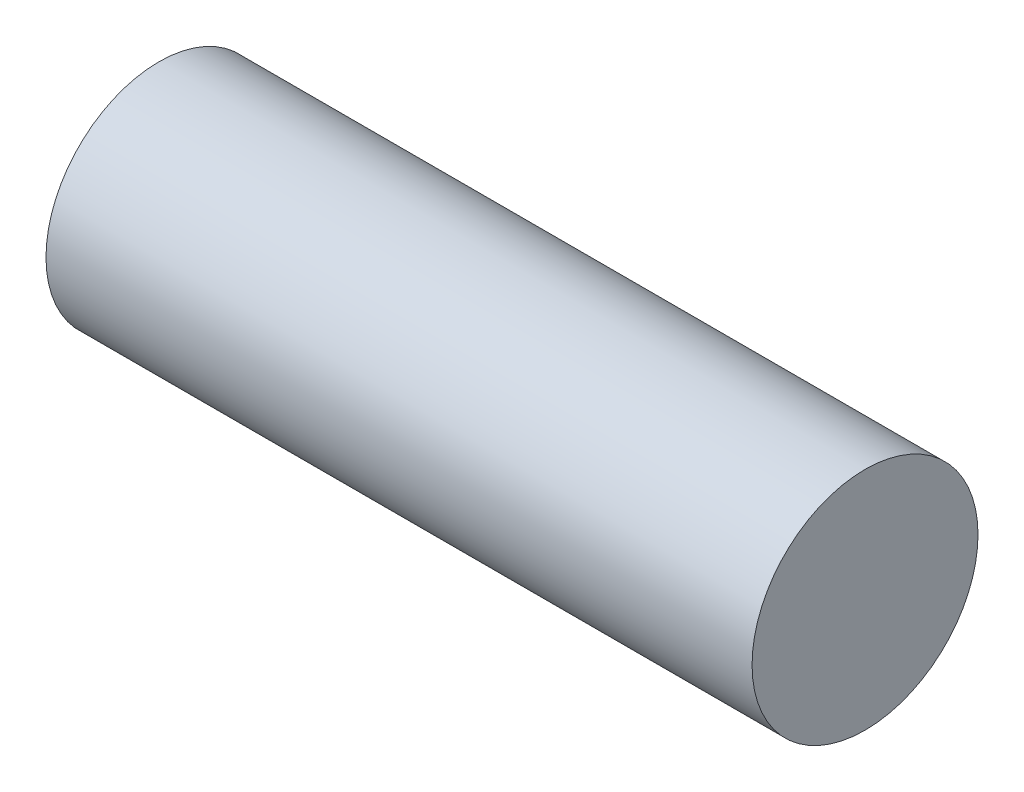
from build123d import *

# Parameters (mm, degrees)
SKETCH28_R = 40
SKETCH30_R = 40


with BuildPart() as part:
    # Sketch28 → Loft2 section 0
    with BuildSketch(Plane(origin=(590, 0, 0), x_dir=(0, 0, -1), z_dir=(1, 0, 0))):
        Circle(SKETCH28_R)
    # Sketch30 → Loft2 section 1
    with BuildSketch(Plane(origin=(340, 0, 0), x_dir=(0, 0, -1), z_dir=(1, 0, 0))):
        Circle(SKETCH30_R)
    loft()


solid = part.part
